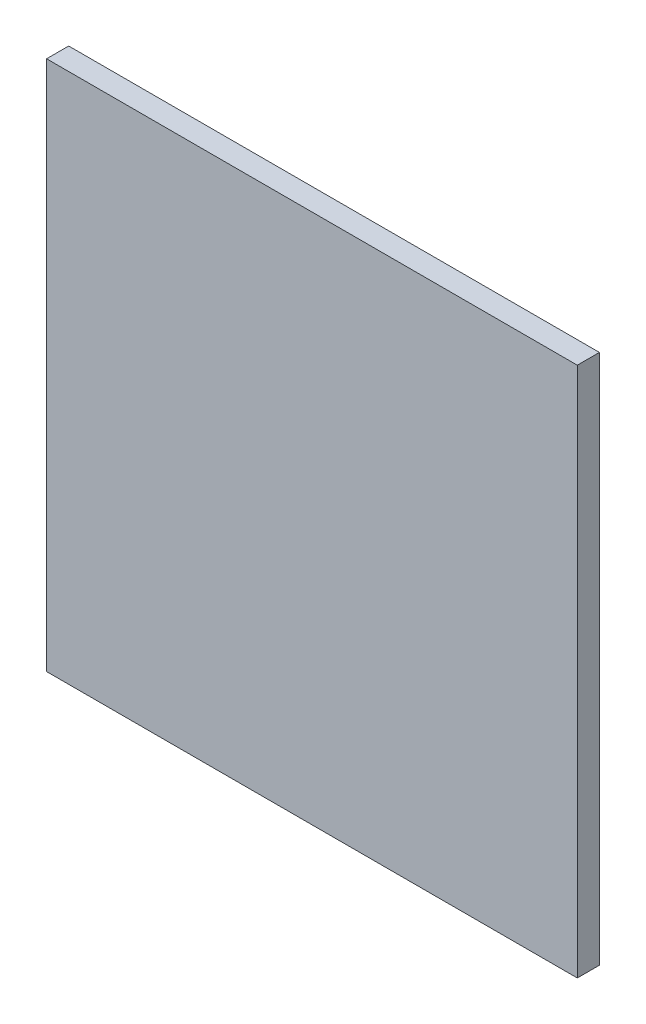
from build123d import *

# Parameters (mm, degrees)
CROQUIS1_W              = 120
CROQUIS1_H              = 120
SALIENTE_EXTRUIR1_DEPTH = 5
CROQUIS3_W              = 100
CROQUIS3_H              = 100
CORTAR_EXTRUIR1_DEPTH   = 1


with BuildPart() as part:
    # Croquis1 → Saliente-Extruir1 (new body)
    with BuildSketch(Plane.XY):
        Rectangle(CROQUIS1_W, CROQUIS1_H)
    extrude(amount=SALIENTE_EXTRUIR1_DEPTH)

    # Croquis3 → Cortar-Extruir1 (cut)
    with BuildSketch(Plane(origin=(0, 0, 0), x_dir=(-1, 0, 0), z_dir=(0, 0, -1))):
        Rectangle(CROQUIS3_W, CROQUIS3_H)
    extrude(amount=-CORTAR_EXTRUIR1_DEPTH, mode=Mode.SUBTRACT)


solid = part.part
